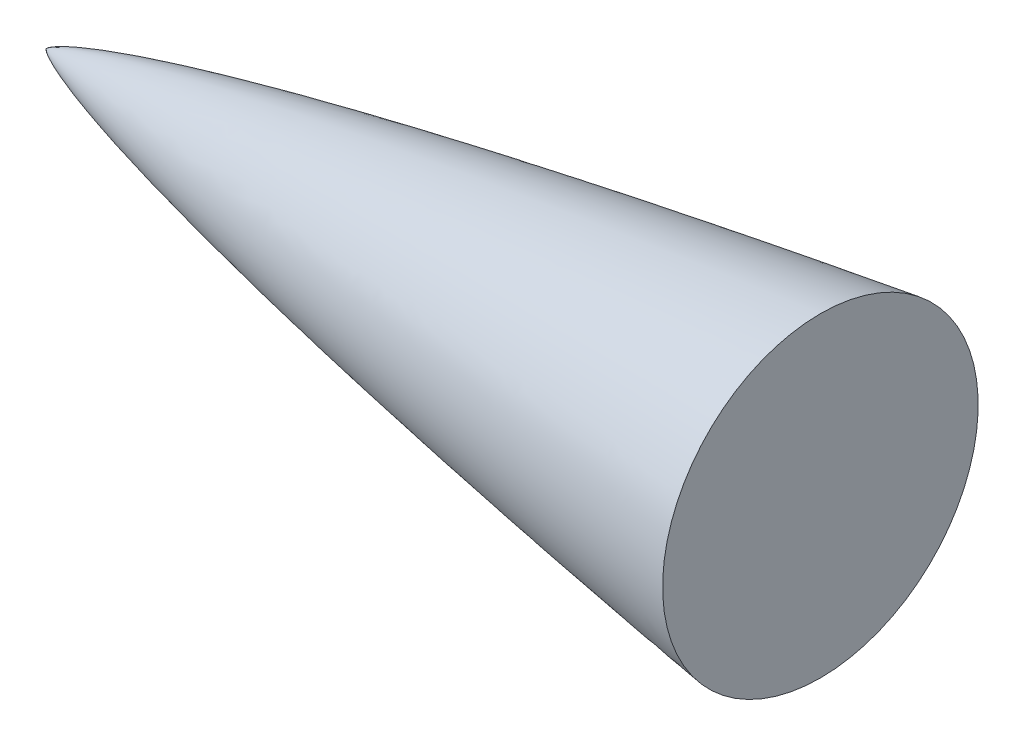
from build123d import *

# Parameters (mm, degrees)
SKETCH8_R           = 83.841254666
BOSS_EXTRUDE1_DEPTH = 10.16
SKETCH9_R           = 117.461252673
CUT_EXTRUDE1_DEPTH  = 681.99


with BuildPart() as part:
    # Sketch7 → Revolve3 (revolve)
    with BuildSketch(Plane.XY):
        with BuildLine():
            Line((762, 83.841254666), (762, 0))
            Line((762, 0), (0, 0))
            add(Edge.make_bspline(
                [(0, 0), (0.002469036, 0.007698152), (0.00852038, 0.022545642), (0.025428785, 0.049911406), (0.065694849, 0.100096678), (0.127523873, 0.163176144), (0.212062429, 0.237272493), (0.332279694, 0.331578396), (0.47681638, 0.434147846), (0.646496772, 0.544815952), (0.841412681, 0.663024364), (1.126864222, 0.82633392), (1.572744504, 1.062892156), (2.33539055, 1.432268664), (3.710931738, 2.02979685), (6.154578127, 2.969838304), (10.668005752, 4.490267325), (18.999517068, 6.917303838), (33.385795617, 10.520869917), (58.214680344, 15.881727226), (92.501407111, 22.236378549), (134.347160824, 29.066892837), (181.232321928, 35.913847395), (228.199436648, 42.167572329), (275.229416109, 47.928683924), (322.309575865, 53.261898342), (369.432294544, 58.204857708), (416.591925172, 62.781349507), (463.784734462, 67.002125548), (511.007900045, 70.868414522), (558.259527802, 74.370378395), (605.538293137, 77.485800464), (646.930327879, 79.837294836), (682.425589554, 81.539197971), (710.863439026, 82.65535626), (729.852911101, 83.259007577), (745.309411706, 83.632760833), (754.846503834, 83.785926018), (759.61543609, 83.834878653), (762, 83.841254666)],
                knots=[0, 0, 0, 0, 0, 4.177e-05, 8.3539e-05, 0.000167079, 0.000334158, 0.000501236, 0.000668315, 0.000962463, 0.001256611, 0.001555846, 0.001855081, 0.002674694, 0.003884179, 0.005967022, 0.009661666, 0.016303633, 0.028675652, 0.051140007, 0.0868676, 0.148543873, 0.210220157, 0.271896443, 0.333572727, 0.395249011, 0.456925295, 0.518601581, 0.580277867, 0.641954151, 0.703630435, 0.765306721, 0.826983006, 0.888659291, 0.919497433, 0.950335576, 0.975167788, 0.987583894, 1, 1, 1, 1, 1], degree=4))
        make_face()
    revolve(axis=Axis((0, 0, 0), (1, 0, 0)))

    # Sketch8 → Boss-Extrude1 (add)
    with BuildSketch(Plane(origin=(762, 0, 0), x_dir=(0, 0, -1), z_dir=(1, 0, 0))):
        with Locations(Location((0, 0, 0), (0, 0, 90))):
            Circle(SKETCH8_R)
    extrude(amount=BOSS_EXTRUDE1_DEPTH)

    # Sketch9 → Cut-Extrude1 (cut)
    with BuildSketch(Plane(origin=(162.56, 0, 0), x_dir=(0, 0, -1), z_dir=(1, 0, 0))):
        Circle(SKETCH9_R)
    extrude(amount=CUT_EXTRUDE1_DEPTH, mode=Mode.SUBTRACT)


solid = part.part
